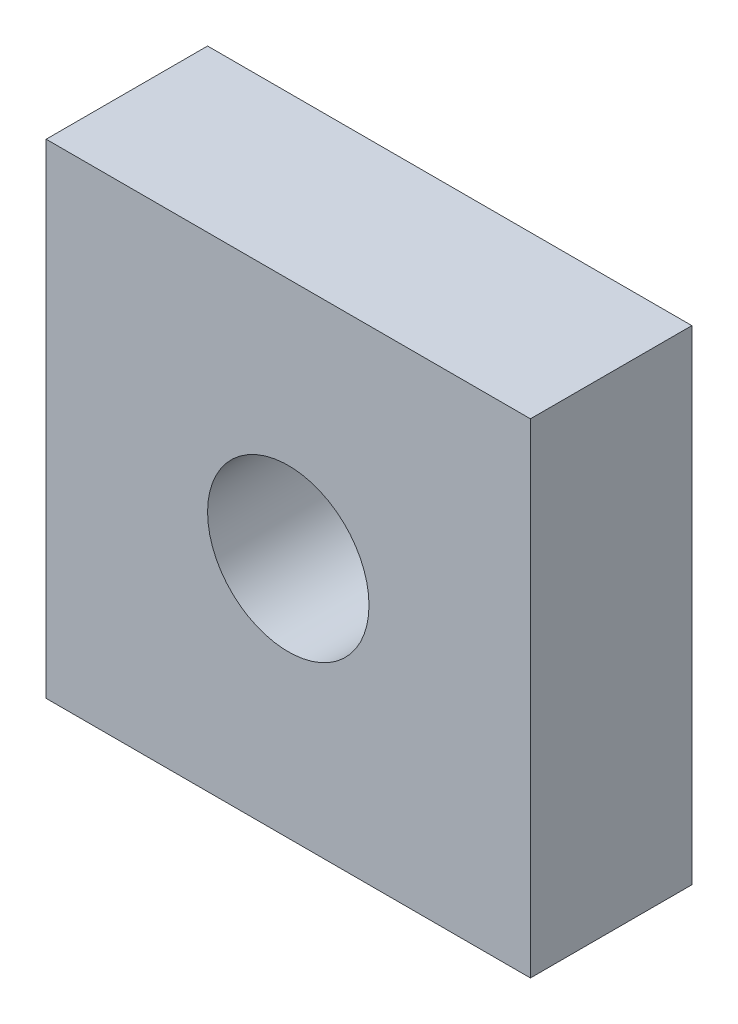
from build123d import *

# Parameters (mm, degrees)
SKETCH1_W           = 6
SKETCH1_H           = 6
BOSS_EXTRUDE1_DEPTH = 2
SKETCH2_R           = 1
CUT_EXTRUDE1_DEPTH  = 9.717797887


with BuildPart() as part:
    # Sketch1 → Boss-Extrude1 (new body)
    with BuildSketch(Plane.XY):
        with Locations((3, 3)):
            Rectangle(SKETCH1_W, SKETCH1_H)
    extrude(amount=BOSS_EXTRUDE1_DEPTH)

    # Sketch2 → Cut-Extrude1 (cut, through all)
    with BuildSketch(Plane(origin=(0, 0, 0), x_dir=(-1, 0, 0), z_dir=(0, 0, -1))):
        with Locations((-3, 3)):
            Circle(SKETCH2_R)
    extrude(amount=-CUT_EXTRUDE1_DEPTH, mode=Mode.SUBTRACT)


solid = part.part
